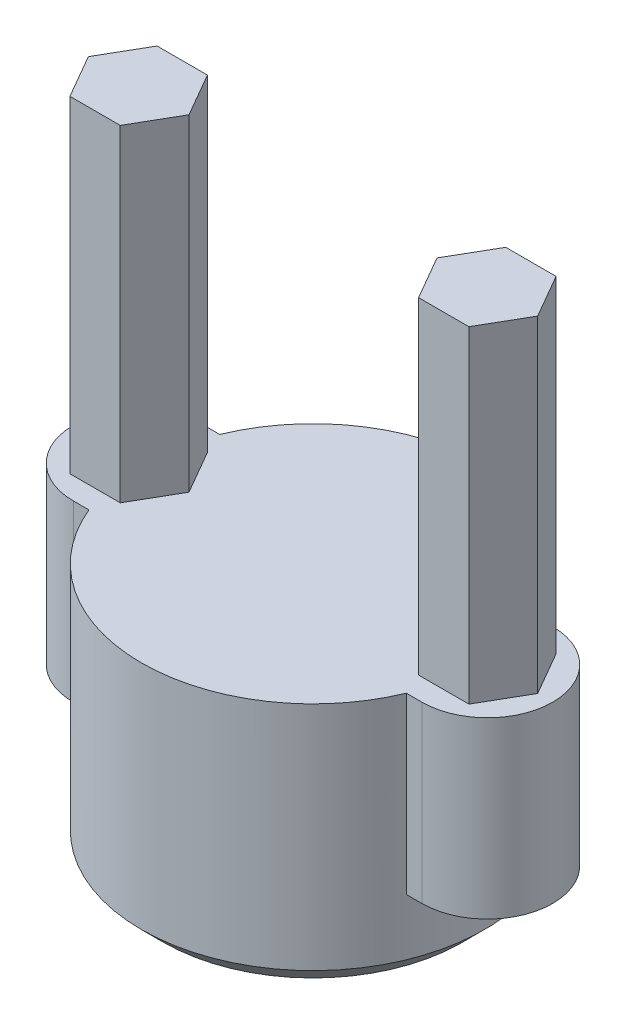
from build123d import *

# Parameters (mm, degrees)
SKETCH1_R           = 7.875
BOSS_EXTRUDE1_DEPTH = 11.6
BOSS_EXTRUDE2_DEPTH = 8
BOSS_EXTRUDE3_DEPTH = 15
CHAMFER1_SIZE       = 1


with BuildPart() as part:
    # Sketch1 → Boss-Extrude1 (new body)
    with BuildSketch(Plane(origin=(0, 0, 0), x_dir=(1, 0, 0), z_dir=(0, 1, 0))):
        with Locations(Location((0, 0, 0), (0, 0, 270))):
            Circle(SKETCH1_R)
    extrude(amount=-BOSS_EXTRUDE1_DEPTH)

    # Sketch2 → Boss-Extrude2 (add)
    with BuildSketch(Plane(origin=(0, 0, 0), x_dir=(1, 0, 0), z_dir=(0, 1, 0))):
        with BuildLine():
            Line((-8, 3), (-7.28118294, 3))
            ThreePointArc((-7.28118294, 3), (-7.875, 0), (-7.28118294, -3))
            Line((-7.28118294, -3), (-8, -3))
            ThreePointArc((-8, -3), (-11, 0), (-8, 3))
        make_face()
        with BuildLine():
            Line((8, -3), (7.28118294, -3))
            ThreePointArc((7.28118294, -3), (7.875, 0), (7.28118294, 3))
            Line((7.28118294, 3), (8, 3))
            ThreePointArc((8, 3), (11, 0), (8, -3))
        make_face()
    extrude(amount=-BOSS_EXTRUDE2_DEPTH)

    # Sketch3 → Boss-Extrude3 (add)
    with BuildSketch(Plane(origin=(0, 0, 0), x_dir=(1, 0, 0), z_dir=(0, 1, 0))):
        Polygon((6.845299462, -2), (5.690598923, 0), (6.845299462, 2), (9.154700538, 2), (10.309401077, 0), (9.154700538, -2), align=None)
        Polygon((-5.690598923, 0), (-6.845299462, 2), (-9.154700538, 2), (-10.309401077, 0), (-9.154700538, -2), (-6.845299462, -2), align=None)
    extrude(amount=BOSS_EXTRUDE3_DEPTH)

    # Sketch4 → Revolve1 (revolve)
    with BuildSketch(Plane.XY, mode=Mode.PRIVATE) as revolve1_sk:
        with BuildLine():
            Line((0, -11.6), (5.15, -11.6))
            ThreePointArc((5.15, -11.6), (3.085551004, -14.073334609), (0, -15))
            Line((0, -15), (0, -11.6))
        make_face()
    revolve(revolve1_sk.sketch.rotate(Axis((0, -15, 0), (0, 1, 0)), 180), axis=Axis((0, -15, 0), (0, 1, 0)))

    # Chamfer1
    chamfer1_edges = [part.edges().sort_by_distance(p)[0] for p in [
        (0, -11.6, -7.875),
    ]]
    chamfer(chamfer1_edges, length=CHAMFER1_SIZE)


solid = part.part
